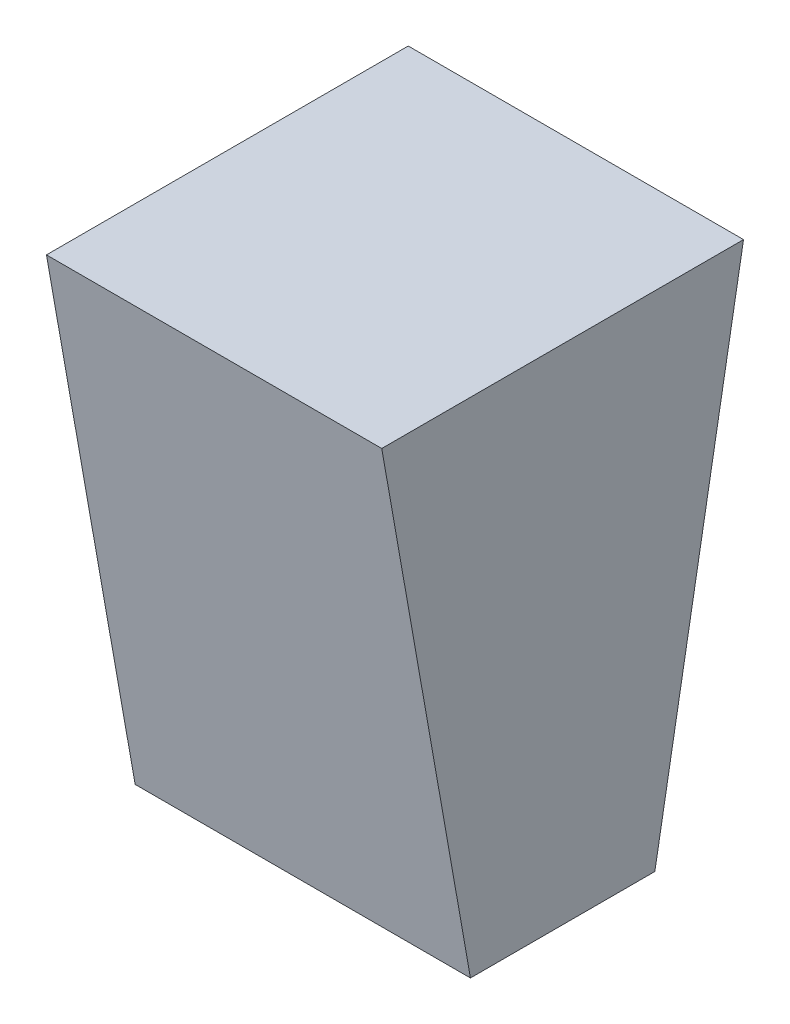
from build123d import *

# Parameters (mm, degrees)
SALIENTE_EXTRUIR1_DEPTH = 200


with BuildPart() as part:
    # Croquis1 → Saliente-Extruir1 (new body)
    with BuildSketch(Plane(origin=(0, 0, 0), x_dir=(0, 0, -1), z_dir=(1, 0, 0))):
        Polygon((0, 0), (110, 0), (162.898094213, 300), (-52.898094213, 300), align=None)
    extrude(amount=SALIENTE_EXTRUIR1_DEPTH)


solid = part.part
